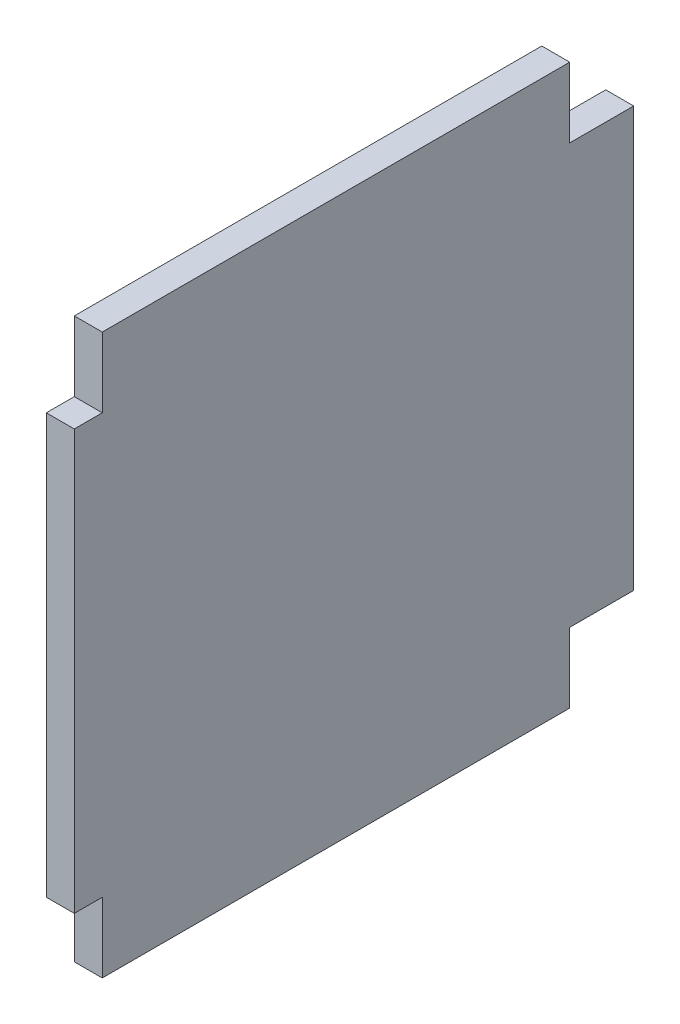
from build123d import *

# Parameters (mm, degrees)
ESTRUSIONE_ESTRUSIONE1_DEPTH      = 35.42788
ESTRUSIONE_ESTRUSIONE1_DEPTH_BACK = 4.57212
SCHIZZO1_W                        = 2
SCHIZZO1_H                        = 30
SCHIZZO2_W                        = 2
SCHIZZO2_H                        = 33.42788034
ESTRUSIONE_ESTRUSIONE2_DEPTH      = 5


with BuildPart() as part:
    # Schizzo1 → Estrusione-Estrusione1 (new, two sides: drawn at the far end of the back side and taken through both)
    with BuildSketch(Plane.XY.offset(-ESTRUSIONE_ESTRUSIONE1_DEPTH_BACK)):
        with Locations((215, 0)):
            Rectangle(SCHIZZO1_W, SCHIZZO1_H)
    extrude(amount=ESTRUSIONE_ESTRUSIONE1_DEPTH + ESTRUSIONE_ESTRUSIONE1_DEPTH_BACK)

    # Schizzo2 → Estrusione-Estrusione2 (add)
    with BuildSketch(Plane.XZ.offset(15)):
        with Locations((215, 16.71394017)):
            Rectangle(SCHIZZO2_W, SCHIZZO2_H)
    estrusione_estrusione2 = extrude(amount=ESTRUSIONE_ESTRUSIONE2_DEPTH)

    # Specchia1: Estrusione-Estrusione2 across plane
    add(estrusione_estrusione2.mirror(Plane.ZX))


solid = part.part
